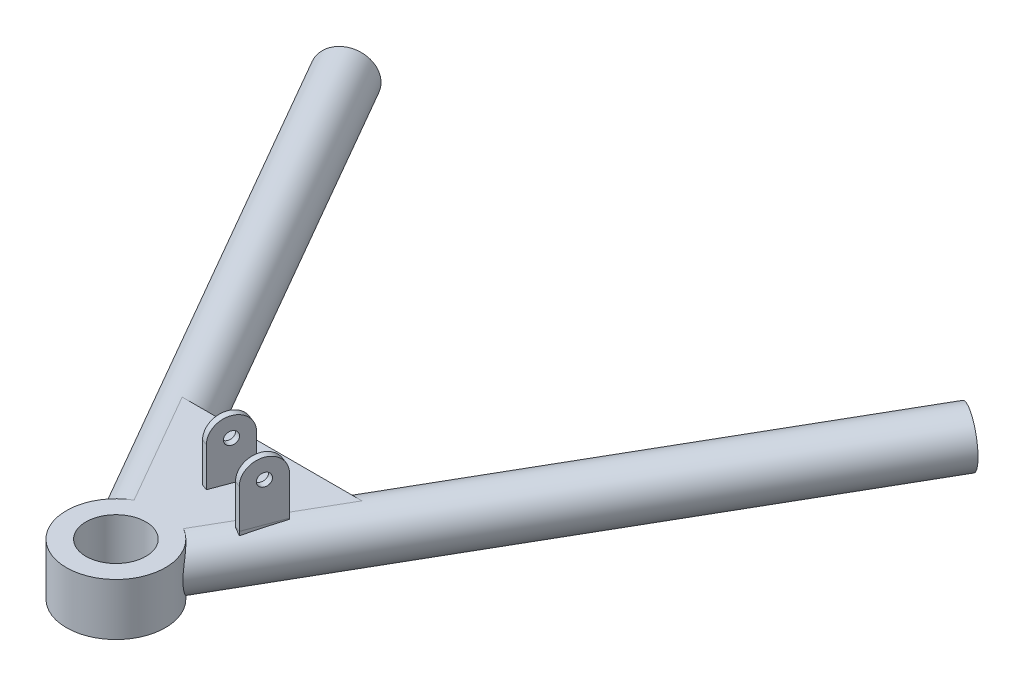
from build123d import *

# Parameters (mm, degrees)
SKETCH1_R                = 19.0062
SKETCH1_R_2              = 11.5062
BOSS_EXTRUDE1_DEPTH      = 10
BOSS_EXTRUDE2_REACH      = 268.113
BOSS_EXTRUDE2_END_RADIUS = 19.0062
SKETCH5_R                = 10
SKETCH5_R_2              = 7
BOSS_EXTRUDE3_REACH      = 338.296
BOSS_EXTRUDE3_END_RADIUS = 19.0062
SKETCH6_R                = 10
SKETCH6_R_2              = 7
BOSS_EXTRUDE7_DEPTH      = 7.5
SKETCH14_R               = 2.413
BOSS_EXTRUDE8_DEPTH      = 12.025
SKETCH14_3_R             = 2.413
CUT_EXTRUDE1_DEPTH       = 9.525
SKETCH15_W               = 15
SKETCH15_H               = 2
BOSS_EXTRUDE9_DEPTH      = 2.5


with BuildPart() as part:
    # Sketch1 → Boss-Extrude1 (new, symmetric)
    with BuildSketch(Plane(origin=(0, 0, 0), x_dir=(1, 0, 0), z_dir=(0, 1, 0))):
        with Locations(Location((0, 0, 0), (0, 0, 270))):
            Circle(SKETCH1_R)
        with Locations(Location((0, 0, 0), (0, 0, 270))):
            Circle(SKETCH1_R_2, mode=Mode.SUBTRACT)
    extrude(amount=BOSS_EXTRUDE1_DEPTH, both=True)

    # Boss-Extrude2: up to this cylinder (the profile starts outside it)
    boss_extrude2_end = Plane(origin=(0, 0, 0), z_dir=(0, -1, 0)) * Cylinder(BOSS_EXTRUDE2_END_RADIUS, 575.2384, mode=Mode.PRIVATE)
    # Sketch5 → Boss-Extrude2 (add, up to the surface)
    with BuildSketch(Plane(origin=(119.67422463, 0, -207.893924576), x_dir=(0.86666261208593, 0, 0.4988946951135007), z_dir=(0.4988946951135007, 0, -0.86666261208593)), mode=Mode.PRIVATE) as boss_extrude2_sk1:
        with Locations(Location((0, 0, 0), (0, 0, 180))):
            Circle(SKETCH5_R)
        with Locations(Location((0, 0, 0), (0, 0, 180))):
            Circle(SKETCH5_R_2, mode=Mode.SUBTRACT)
    boss_extrude2_tool1 = extrude(boss_extrude2_sk1.sketch, amount=-BOSS_EXTRUDE2_REACH, mode=Mode.PRIVATE) - boss_extrude2_end
    add(boss_extrude2_tool1.solids().sort_by_distance((128.095722, 0, -203.046086))[0])

    # Boss-Extrude3: up to this cylinder (the profile starts outside it)
    boss_extrude3_end = Plane(origin=(0, 0, 0), z_dir=(0, -1, 0)) * Cylinder(BOSS_EXTRUDE3_END_RADIUS, 715.6044, mode=Mode.PRIVATE)
    # Sketch6 → Boss-Extrude3 (add, up to the surface)
    with BuildSketch(Plane(origin=(-119.67422463, 0, -207.893924576), x_dir=(-0.8666626120859262, 0, 0.49889469511350737), z_dir=(-0.4988946951135073, 0, -0.8666626120859261)), mode=Mode.PRIVATE) as boss_extrude3_sk1:
        Circle(SKETCH6_R)
        Circle(SKETCH6_R_2, mode=Mode.SUBTRACT)
    boss_extrude3_tool1 = extrude(boss_extrude3_sk1.sketch, amount=-BOSS_EXTRUDE3_REACH, mode=Mode.PRIVATE) - boss_extrude3_end
    add(boss_extrude3_tool1.solids().sort_by_distance((-111.252728, 0, -212.741763))[0])

    # Sketch13 → Boss-Extrude7 (add)
    with BuildSketch(Plane(origin=(0, 10, 0), x_dir=(1, 0, 0), z_dir=(0, 1, 0))):
        with BuildLine():
            Line((9.482092354, 16.471962938), (34.539025094, 60))
            Line((34.539025094, 60), (-34.539025094, 60))
            Line((-34.539025094, 60), (-9.482092354, 16.471962938))
            ThreePointArc((-9.482092354, 16.471962938), (0, 19.0062), (9.482092354, 16.471962938))
        make_face()
    extrude(amount=-BOSS_EXTRUDE7_DEPTH)

    # Sketch14 → Boss-Extrude8 (add, symmetric)
    with BuildSketch(Plane(origin=(-1.308996148, 0, -0.488385142), x_dir=(-0.34956145752045137, 0, 0.936913436458341), z_dir=(-0.9369134364583409, 0, -0.3495614575204513))):
        with BuildLine():
            Line((-47.003772086, 10), (-47.003772086, 25))
            ThreePointArc((-47.003772086, 25), (-39.503772086, 32.5), (-32.003772086, 25))
            Line((-32.003772086, 25), (-32.003772086, 10))
            Line((-32.003772086, 10), (-47.003772086, 10))
        make_face()
        with Locations(Location((-39.503772086, 25, 0), (0, 0, 180))):
            Circle(SKETCH14_R, mode=Mode.SUBTRACT)
    extrude(amount=BOSS_EXTRUDE8_DEPTH, both=True)

    # Sketch14<3> → Cut-Extrude1 (cut, symmetric)
    with BuildSketch(Plane(origin=(-1.308996148, 0, -0.488385142), x_dir=(-0.34956145752045137, 0, 0.936913436458341), z_dir=(-0.9369134364583409, 0, -0.3495614575204513))):
        with BuildLine():
            Line((-47.003772086, 10), (-47.003772086, 25))
            ThreePointArc((-47.003772086, 25), (-39.503772086, 32.5), (-32.003772086, 25))
            Line((-32.003772086, 25), (-32.003772086, 10))
            Line((-32.003772086, 10), (-47.003772086, 10))
        make_face()
        with Locations(Location((-39.503772086, 25, 0), (0, 0, 180))):
            Circle(SKETCH14_3_R, mode=Mode.SUBTRACT)
    extrude(amount=CUT_EXTRUDE1_DEPTH, both=True, mode=Mode.SUBTRACT)


with BuildPart() as cut_extrude1_piece_1:
    # of the separate pieces the step leaves, piece 1, a body of its own (cut_extrude1_pieces)
    add(part.part.solids().sort_by_distance((111.007598509, 0, -212.882871527))[0])

    # Sketch15 → Boss-Extrude9 (add)
    with BuildSketch(Plane(origin=(9.957387925, 0, 3.715091385), x_dir=(0.3495614575204513, 0, -0.936913436458341), z_dir=(0.936913436458341, 0, 0.3495614575204513))):
        with Locations((39.503772086, 9)):
            Rectangle(SKETCH15_W, SKETCH15_H)
    extrude(amount=-BOSS_EXTRUDE9_DEPTH)


with BuildPart() as cut_extrude1_piece_2:
    # of the separate pieces the step leaves, piece 2, a body of its own (cut_extrude1_pieces)
    add(part.part.solids().sort_by_distance((21.144673142, 10, -26.2696727))[0])


solid = Compound([cut_extrude1_piece_1.part, cut_extrude1_piece_2.part])
